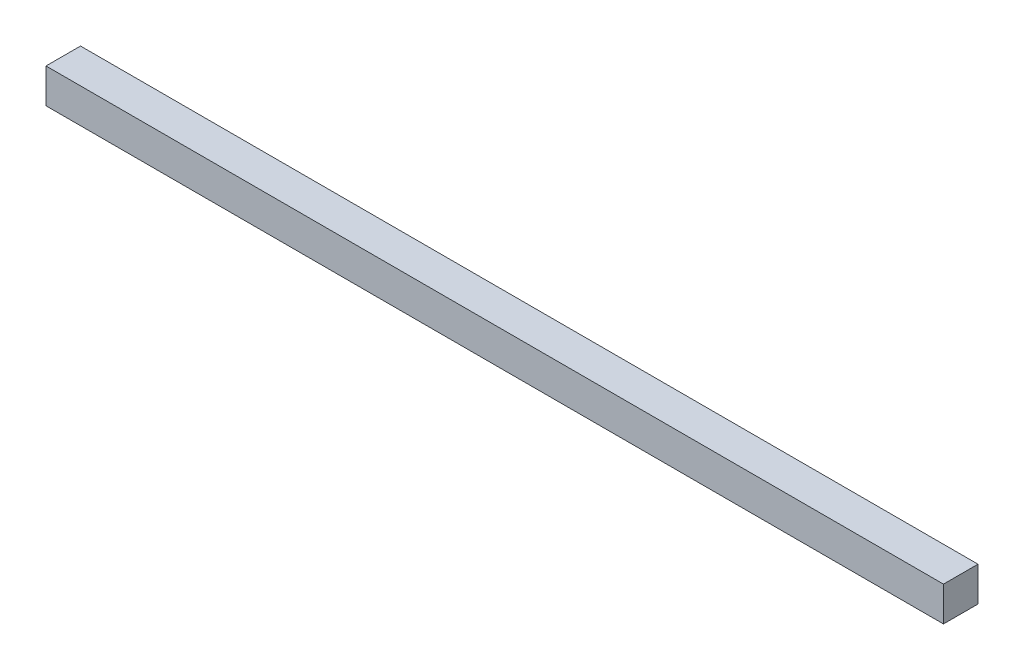
from build123d import *

# Parameters (mm, degrees)
SKETCH_1_W         = 650
SKETCH_1_H         = 25
BLOCKEXTRUDE_DEPTH = 25


with BuildPart() as part:
    # 草图1 → BlockExtrude (new body)
    with BuildSketch(Plane.XY):
        with Locations((325, 12.5)):
            Rectangle(SKETCH_1_W, SKETCH_1_H)
    extrude(amount=BLOCKEXTRUDE_DEPTH)


solid = part.part
